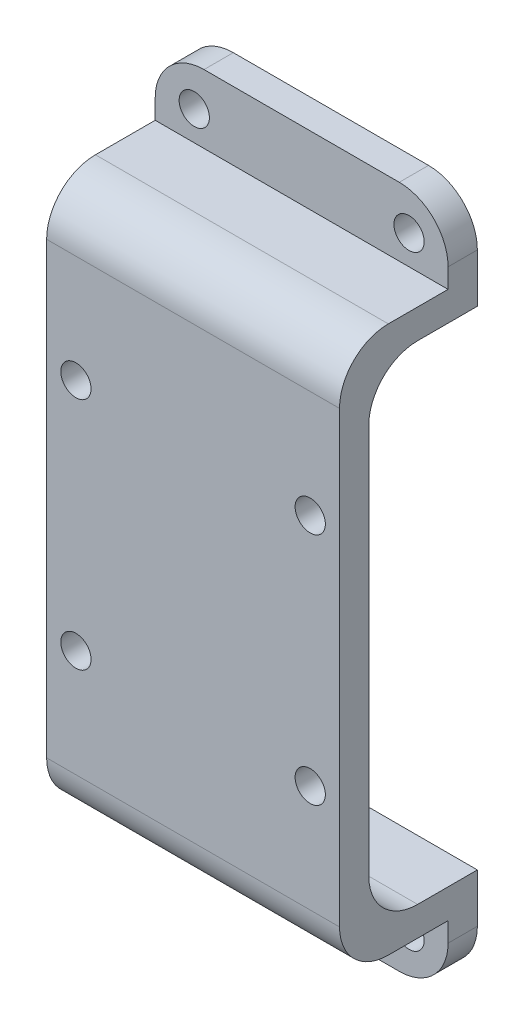
from build123d import *

# Parameters (mm, degrees)
CROQUIS1_R                = 3.1
SALIENTE_EXTRUIR1_DEPTH   = 6
SALIENTE_EXTRUIR1_2_DEPTH = 6
CROQUIS3_W                = 60
CROQUIS3_H                = 6
SALIENTE_EXTRUIR2_DEPTH   = 16.24
CROQUIS4_W                = 60
CROQUIS4_H                = 112
SALIENTE_EXTRUIR3_DEPTH   = 6
REDONDEO1_R               = 10
CROQUIS5_R                = 3.1
CORTAR_EXTRUIR1_DEPTH     = 264.693121755


with BuildPart() as part:
    # Croquis1 → Saliente-Extruir1 (new body)
    with BuildSketch(Plane.XY):
        with BuildLine():
            Line((51.893497848, -217.1), (111.893497848, -217.1))
            Line((111.893497848, -217.1), (111.893497848, -227.1))
            ThreePointArc((111.893497848, -227.1), (108.96456566, -234.171067812), (101.893497848, -237.1))
            Line((101.893497848, -237.1), (61.893497848, -237.1))
            ThreePointArc((61.893497848, -237.1), (54.822430037, -234.171067812), (51.893497848, -227.1))
            Line((51.893497848, -227.1), (51.893497848, -217.1))
        make_face()
        with Locations(Location((59.893497848, -229.1, 0), (0, 0, 180))):
            Circle(CROQUIS1_R, mode=Mode.SUBTRACT)
        with Locations((103.893497848, -229.1)):
            Circle(CROQUIS1_R, mode=Mode.SUBTRACT)
    extrude(amount=SALIENTE_EXTRUIR1_DEPTH)



with BuildPart() as body_2:
    # Croquis1 → Saliente-Extruir1 2 (new body)
    with BuildSketch(Plane.XY):
        with BuildLine():
            Line((61.893497848, -97.1), (101.893497848, -97.1))
            ThreePointArc((101.893497848, -97.1), (108.96456566, -100.028932188), (111.893497848, -107.1))
            Line((111.893497848, -107.1), (111.893497848, -117.1))
            Line((111.893497848, -117.1), (51.893497848, -117.1))
            Line((51.893497848, -117.1), (51.893497848, -107.1))
            ThreePointArc((51.893497848, -107.1), (54.822430037, -100.028932188), (61.893497848, -97.1))
        make_face()
        with Locations((59.893497848, -105.1)):
            Circle(CROQUIS1_R, mode=Mode.SUBTRACT)
        with Locations(Location((103.893497848, -105.1, 0), (0, 0, 180))):
            Circle(CROQUIS1_R, mode=Mode.SUBTRACT)
    extrude(amount=SALIENTE_EXTRUIR1_2_DEPTH)


with BuildPart() as part_1:
    add(part.part)

    add(body_2.part)  # Saliente-Extruir2 merges body 2
    # Croquis3 → Saliente-Extruir2 (add)
    with BuildSketch(Plane.XY.offset(6)):
        with Locations((81.893497848, -220.1)):
            Rectangle(CROQUIS3_W, CROQUIS3_H)
        with Locations((81.893497848, -114.1)):
            Rectangle(CROQUIS3_W, CROQUIS3_H)
    extrude(amount=SALIENTE_EXTRUIR2_DEPTH)

    # Croquis4 → Saliente-Extruir3 (add)
    with BuildSketch(Plane.XY.offset(22.24)):
        with Locations((81.893497848, -167.1)):
            Rectangle(CROQUIS4_W, CROQUIS4_H)
    extrude(amount=SALIENTE_EXTRUIR3_DEPTH)

    # Redondeo1
    redondeo1_edges = [part_1.edges().sort_by_distance(p)[0] for p in [
        (81.893497848, -217.1, 22.24),
        (81.893497848, -223.1, 28.24),
        (81.893497848, -111.1, 28.24),
        (81.893497848, -117.1, 22.24),
    ]]
    fillet(redondeo1_edges, radius=REDONDEO1_R)

    # Croquis5 → Cortar-Extruir1 (cut, through all)
    with BuildSketch(Plane.XY.offset(28.24)):
        with Locations((105.893497848, -143.1)):
            Circle(CROQUIS5_R)
        with Locations((105.893497848, -191.1)):
            Circle(CROQUIS5_R)
        with Locations((57.893497848, -191.1)):
            Circle(CROQUIS5_R)
        with Locations((57.893497848, -143.1)):
            Circle(CROQUIS5_R)
    extrude(amount=-CORTAR_EXTRUIR1_DEPTH, mode=Mode.SUBTRACT)


solid = part_1.part
